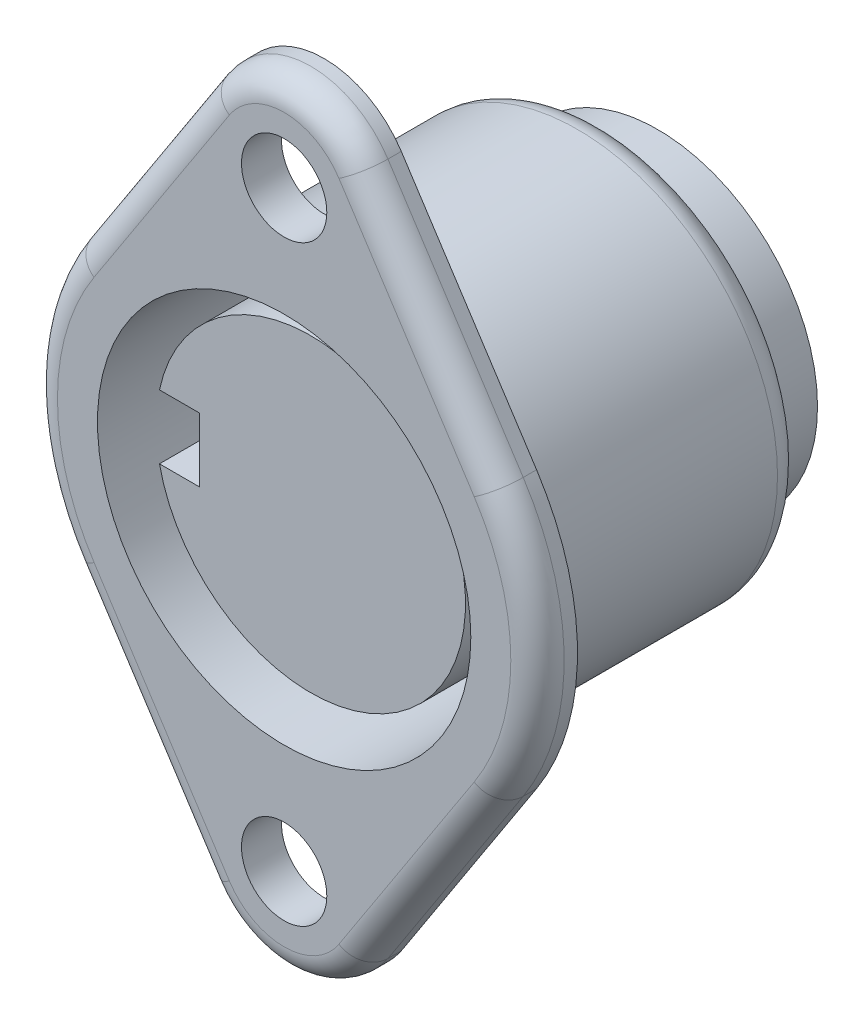
from build123d import *

# Parameters (mm, degrees)
SKETCH1_R           = 7.5
BOSS_EXTRUDE1_DEPTH = 10.5
FILLET1_R           = 1
SKETCH2_R           = 6
BOSS_EXTRUDE2_DEPTH = 2
SKETCH3_R           = 1.6
BOSS_EXTRUDE3_DEPTH = 1.5
FILLET2_R           = 1
SKETCH4_R           = 7
CUT_EXTRUDE1_DEPTH  = 8.34
SKETCH5_R           = 5.8
BOSS_EXTRUDE4_DEPTH = 7.34
CUT_EXTRUDE2_START  = -7.34
CUT_EXTRUDE2_DEPTH  = 7.34


with BuildPart() as part:
    # Sketch1 → Boss-Extrude1 (new body)
    with BuildSketch(Plane.XY):
        with Locations(Location((0, 0, 0), (0, 0, 180))):
            Circle(SKETCH1_R)
    extrude(amount=BOSS_EXTRUDE1_DEPTH)

    # Fillet1
    fillet1_edges = [part.edges().sort_by_distance(p)[0] for p in [
        (7.5, 0, 0),
    ]]
    fillet(fillet1_edges, radius=FILLET1_R)

    # Sketch2 → Boss-Extrude2 (add)
    with BuildSketch(Plane(origin=(0, 0, 0), x_dir=(-1, 0, 0), z_dir=(0, 0, -1))):
        with Locations(Location((0, 0, 0), (0, 0, 180))):
            Circle(SKETCH2_R)
    extrude(amount=BOSS_EXTRUDE2_DEPTH)

    # Sketch3 → Boss-Extrude3 (add)
    with BuildSketch(Plane.XY.offset(10.5)):
        with BuildLine():
            Line((-7.964864241, 5.177927928), (-2.89250333, 12.980405405))
            ThreePointArc((-2.89250333, 12.980405405), (0, 14.55), (2.89250333, 12.980405405))
            Line((2.89250333, 12.980405405), (7.964864241, 5.177927928))
            ThreePointArc((7.964864241, 5.177927928), (9.5, 0), (7.964864241, -5.177927928))
            Line((7.964864241, -5.177927928), (2.89250333, -12.980405405))
            ThreePointArc((2.89250333, -12.980405405), (0, -14.55), (-2.89250333, -12.980405405))
            Line((-2.89250333, -12.980405405), (-7.964864241, -5.177927928))
            ThreePointArc((-7.964864241, -5.177927928), (-9.5, 0), (-7.964864241, 5.177927928))
        make_face()
        with Locations((0, -11.1)):
            Circle(SKETCH3_R, mode=Mode.SUBTRACT)
        with Locations((0, 11.1)):
            Circle(SKETCH3_R, mode=Mode.SUBTRACT)
    extrude(amount=BOSS_EXTRUDE3_DEPTH)

    # Fillet2
    fillet2_edges = [part.edges().sort_by_distance(p)[0] for p in [
        (-9.5, 0, 12),
        (-5.428683785, -9.079166667, 12),
        (0, -14.55, 12),
        (5.428683785, -9.079166667, 12),
        (9.5, 0, 12),
        (5.428683785, 9.079166667, 12),
        (0, 14.55, 12),
        (-5.428683785, 9.079166667, 12),
    ]]
    fillet(fillet2_edges, radius=FILLET2_R)

    # Sketch4 → Cut-Extrude1 (cut)
    with BuildSketch(Plane.XY.offset(12)):
        Circle(SKETCH4_R)
    extrude(amount=-CUT_EXTRUDE1_DEPTH, mode=Mode.SUBTRACT)

    # Sketch5 → Boss-Extrude4 (add)
    with BuildSketch(Plane.XY.offset(3.66)):
        with Locations(Location((0, 0, 0), (0, 0, 180))):
            Circle(SKETCH5_R)
    extrude(amount=BOSS_EXTRUDE4_DEPTH)

    # Sketch6 → Cut-Extrude2 (cut)
    with BuildSketch(Plane.XY.offset(11).offset(CUT_EXTRUDE2_START)):
        with BuildLine():
            Line((-5.674504384, -1.2), (-4.174504384, -1.2))
            Line((-4.174504384, -1.2), (-4.174504384, 1.2))
            Line((-4.174504384, 1.2), (-5.674504384, 1.2))
            ThreePointArc((-5.674504384, 1.2), (-5.8, 0), (-5.674504384, -1.2))
        make_face()
    extrude(amount=CUT_EXTRUDE2_DEPTH, mode=Mode.SUBTRACT)


solid = part.part
